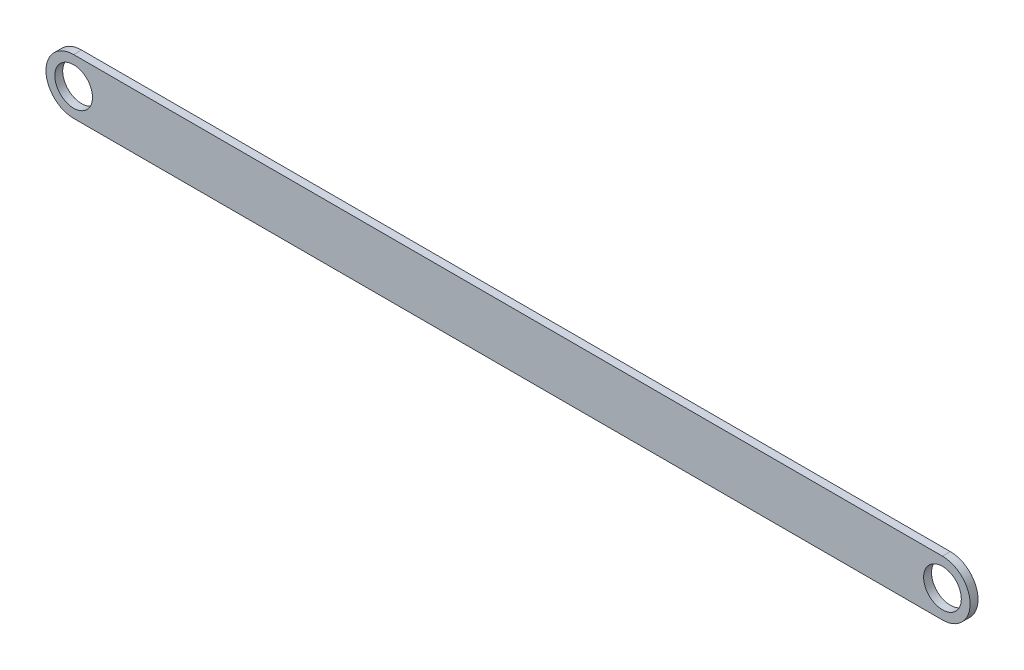
from build123d import *

# Parameters (mm, degrees)
SKETCH_1_R      = 9.54
EXTRUDE_1_DEPTH = 4


with BuildPart() as part:
    # 草图1 → 凸台-拉伸1 (new body)
    with BuildSketch(Plane.XY):
        with BuildLine():
            Line((0, 14), (440, 14))
            ThreePointArc((440, 14), (454, 0), (440, -14))
            Line((440, -14), (0, -14))
            ThreePointArc((0, -14), (-14, 0), (0, 14))
        make_face()
        Circle(SKETCH_1_R, mode=Mode.SUBTRACT)
        with Locations((440, 0)):
            Circle(SKETCH_1_R, mode=Mode.SUBTRACT)
    extrude(amount=EXTRUDE_1_DEPTH)


solid = part.part
